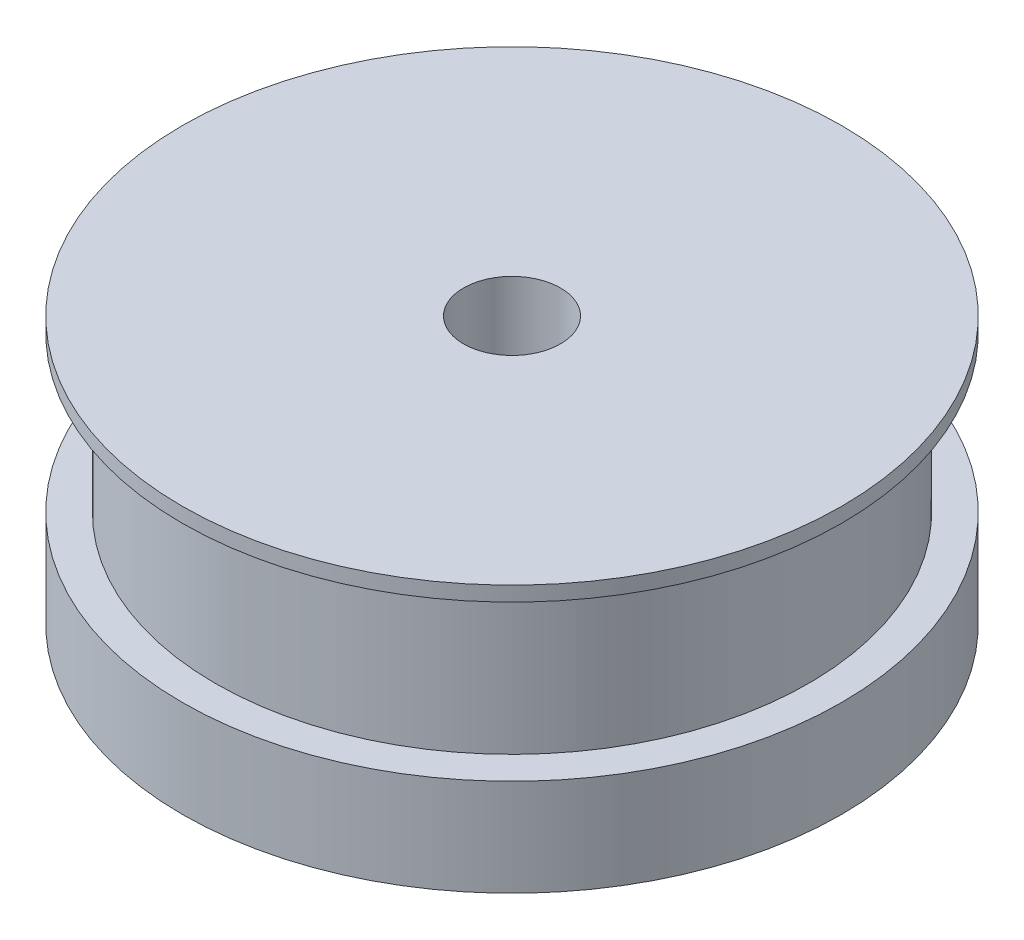
from build123d import *

# Parameters (mm, degrees)
SKETCH1_R           = 21.59
BOSS_EXTRUDE1_DEPTH = 17.4752
SKETCH2_W           = 2.159
SKETCH2_H           = 10.16
SKETCH3_R           = 3.175
CUT_EXTRUDE1_DEPTH  = 17.4752


with BuildPart() as part:
    # Sketch1 → Boss-Extrude1 (new body)
    with BuildSketch(Plane(origin=(0, 0, 0), x_dir=(1, 0, 0), z_dir=(0, 1, 0))):
        with Locations(Location((0, 0, 0), (0, 0, 270))):
            Circle(SKETCH1_R)
    extrude(amount=BOSS_EXTRUDE1_DEPTH)

    # Sketch2 → Cut-Revolve1 (revolve, cut)
    with BuildSketch(Plane(origin=(0, 0, 0), x_dir=(0, 0, -1), z_dir=(1, 0, 0)), mode=Mode.PRIVATE) as cut_revolve1_sk:
        with Locations((20.5105, 11.43)):
            Rectangle(SKETCH2_W, SKETCH2_H)
    revolve(cut_revolve1_sk.sketch.rotate(Axis((0, 18.309331677, 0), (0, -1, 0)), 180), axis=Axis((0, 18.309331677, 0), (0, -1, 0)), mode=Mode.SUBTRACT)

    # Sketch3 → Cut-Extrude1 (cut)
    with BuildSketch(Plane(origin=(0, 17.4752, 0), x_dir=(1, 0, 0), z_dir=(0, 1, 0))):
        with Locations(Location((0, 0, 0), (0, 0, 270))):
            Circle(SKETCH3_R)
    extrude(amount=-CUT_EXTRUDE1_DEPTH, mode=Mode.SUBTRACT)


solid = part.part
